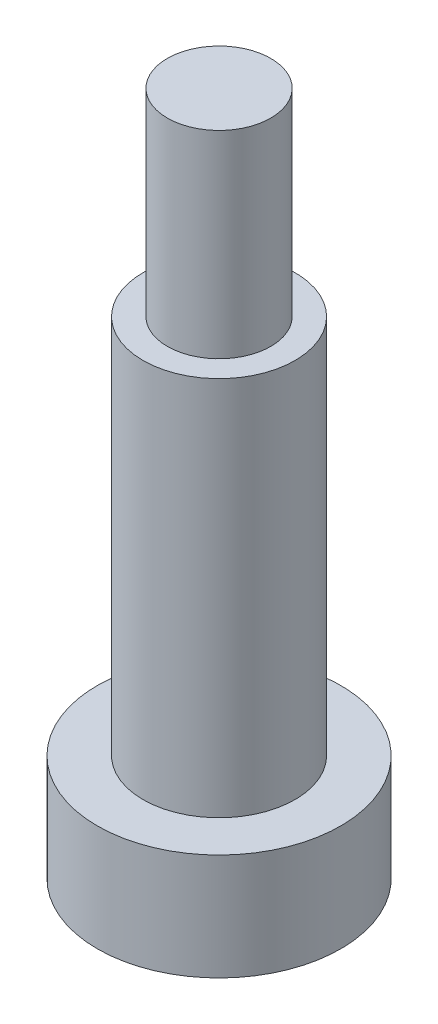
from build123d import *

# Parameters (mm, degrees)
ROSCA_START  = -3.175
CROQUIS1_R   = 3.4
ROSCA_DEPTH  = 13
HOMBRO_START = -28.175
CROQUIS2_R   = 5
HOMBRO_DEPTH = 25
CABEZA_START = -35.175
CROQUIS3_R   = 8
CABEZA_DEPTH = 7
ALLEN_START  = -35.175
CROQUIS4_R   = 3.52
ALLEN_DEPTH  = 4.2


with BuildPart() as part:
    # Croquis1 → Rosca (new body)
    with BuildSketch(Plane(origin=(0, 0, 0), x_dir=(1, 0, 0), z_dir=(0, 1, 0)).offset(ROSCA_START)):
        with Locations(Location((152.4, -171.45, 0), (0, 0, 270))):
            Circle(CROQUIS1_R)
    extrude(amount=ROSCA_DEPTH)

    # Croquis2 → Hombro (add)
    with BuildSketch(Plane(origin=(0, 0, 0), x_dir=(1, 0, 0), z_dir=(0, 1, 0)).offset(HOMBRO_START)):
        with Locations(Location((152.4, -171.45, 0), (0, 0, 270))):
            Circle(CROQUIS2_R)
    extrude(amount=HOMBRO_DEPTH)

    # Croquis3 → Cabeza (add)
    with BuildSketch(Plane(origin=(0, 0, 0), x_dir=(1, 0, 0), z_dir=(0, 1, 0)).offset(CABEZA_START)):
        with Locations(Location((152.4, -171.45, 0), (0, 0, 270))):
            Circle(CROQUIS3_R)
    extrude(amount=CABEZA_DEPTH)

    # Croquis4 → Allen (cut)
    with BuildSketch(Plane(origin=(0, 0, 0), x_dir=(1, 0, 0), z_dir=(0, 1, 0)).offset(ALLEN_START)):
        with Locations(Location((152.4, -171.45, 0), (0, 0, 270))):
            Circle(CROQUIS4_R)
    extrude(amount=ALLEN_DEPTH, mode=Mode.SUBTRACT)


solid = part.part
